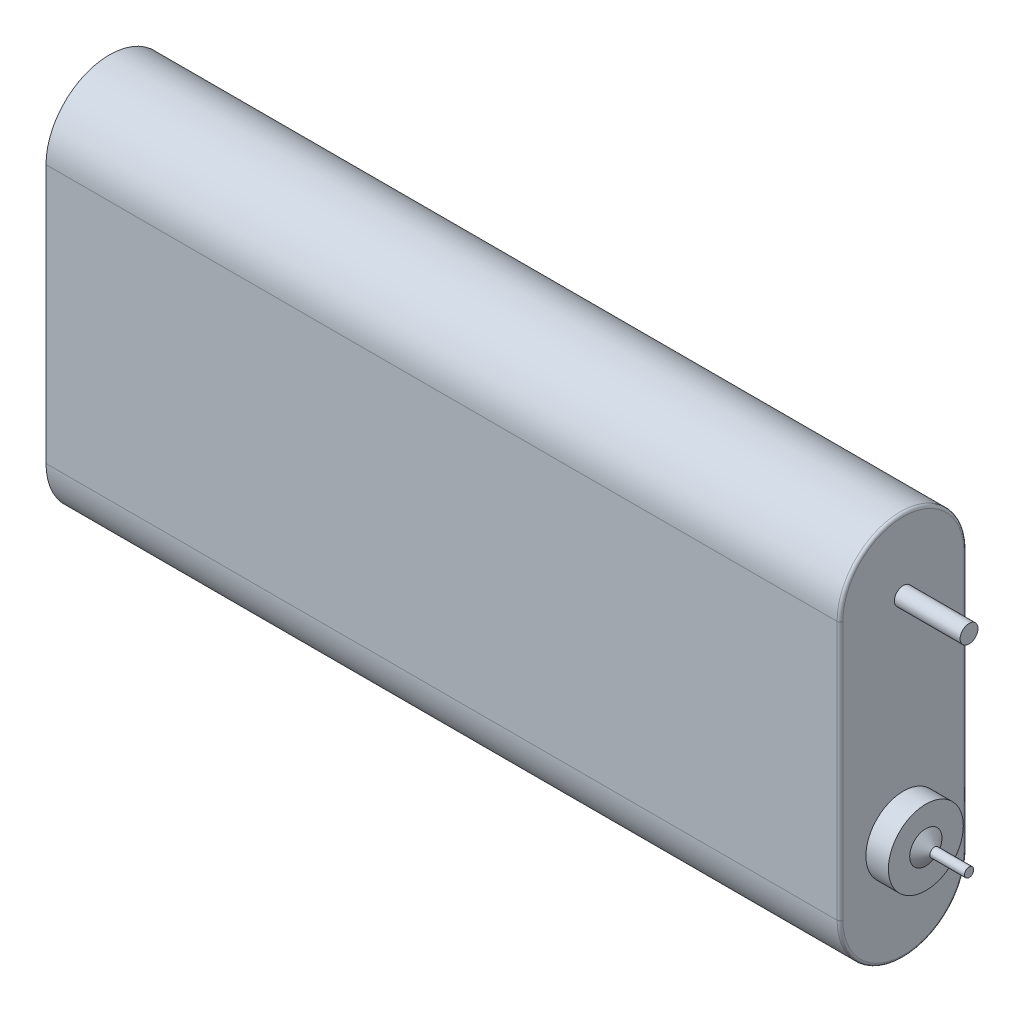
from build123d import *

# Parameters (mm, degrees)
BOSS_EXTRUDE1_DEPTH = 34.9885
SKETCH2_W           = 2.8956
SKETCH2_H           = 0.3937
FILLET1_R           = 0.127
CHAMFER1_SIZE       = 0.508
CHAMFER1_SIZE2      = 0.381


with BuildPart() as part:
    # Sketch1 → Boss-Extrude1 (new body)
    with BuildSketch(Plane(origin=(0, 0, 0), x_dir=(0, -1, 0), z_dir=(-1, 0, 0))):
        with BuildLine():
            Line((5.7023, 2.794), (-5.7023, 2.794))
            ThreePointArc((-5.7023, 2.794), (-8.4963, 0), (-5.7023, -2.794))
            Line((-5.7023, -2.794), (5.7023, -2.794))
            ThreePointArc((5.7023, -2.794), (8.4963, 0), (5.7023, 2.794))
        make_face()
    extrude(amount=-BOSS_EXTRUDE1_DEPTH)

    # Sketch2 → Revolve1 (revolve)
    with BuildSketch(Plane.XY, mode=Mode.PRIVATE) as revolve1_sk:
        with Locations((36.4363, 5.54355)):
            Rectangle(SKETCH2_W, SKETCH2_H)
    revolve(revolve1_sk.sketch.rotate(Axis((34.9885, 5.3467, 0), (1, 0, 0)), 270), axis=Axis((34.9885, 5.3467, 0), (1, 0, 0)))

    # Sketch3 → Revolve2 (revolve)
    with BuildSketch(Plane.XY, mode=Mode.PRIVATE) as revolve2_sk:
        Polygon((34.9885, -2.1082), (34.9885, -3.7592), (37.8841, -3.7592), (37.8841, -3.556), (35.9791, -3.556), (35.9791, -2.1082), align=None)
    revolve(revolve2_sk.sketch.rotate(Axis((34.9885, -3.7592, 0), (1, 0, 0)), 270), axis=Axis((34.9885, -3.7592, 0), (1, 0, 0)))

    # Fillet1
    fillet1_edges = [part.edges().sort_by_distance(p)[0] for p in [
        (34.9885, 8.4963, 0),
        (34.9885, 0, -2.794),
        (34.9885, -8.4963, 0),
        (34.9885, 0, 2.794),
    ]]
    fillet(fillet1_edges, radius=FILLET1_R)

    # Chamfer1
    chamfer1_edges = [part.edges().sort_by_distance(p)[0] for p in [
        (35.9791, -3.7592, 0.2032),
    ]]
    chamfer1_side = [part.faces().sort_by_distance(p)[0] for p in [
        (35.9791, -3.7592, 0.249897332),
    ]]
    chamfer(chamfer1_edges, length=CHAMFER1_SIZE, length2=CHAMFER1_SIZE2, reference=chamfer1_side[0])


solid = part.part
